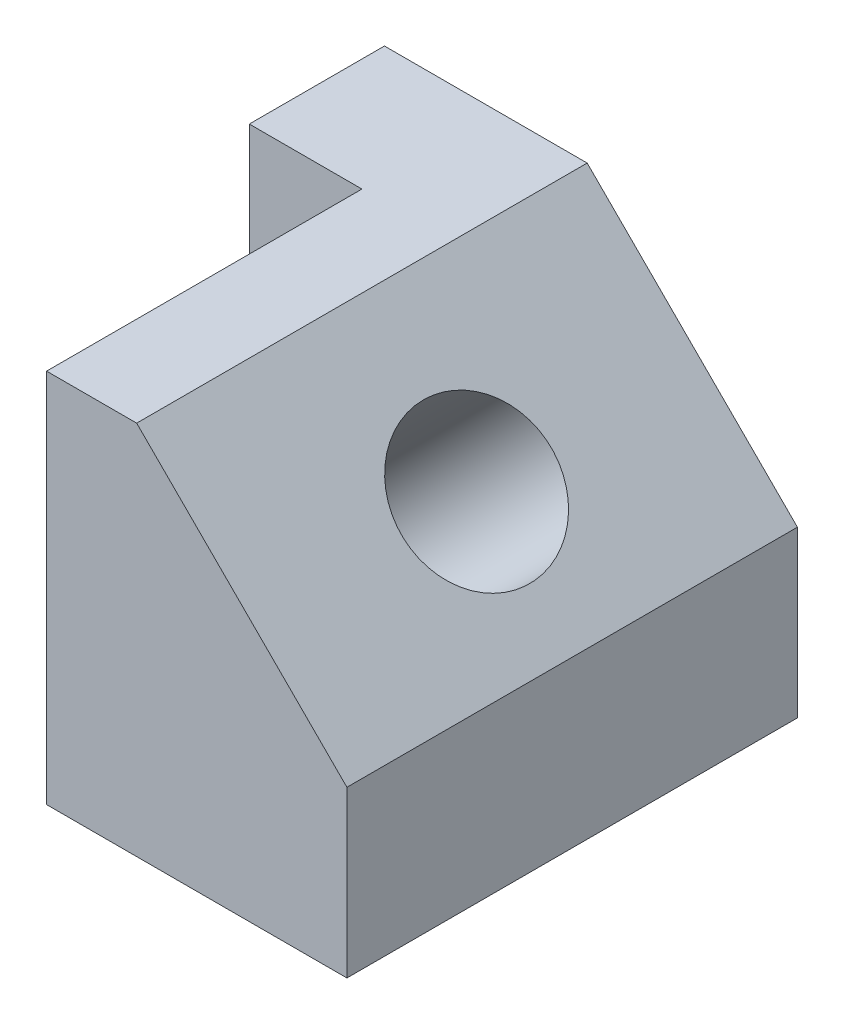
from build123d import *

# Parameters (mm, degrees)
SKETCH1_W           = 15
SKETCH1_H           = 50
BOSS_EXTRUDE1_DEPTH = 18
BOSS_EXTRUDE2_DEPTH = 60
SKETCH2_R           = 10
CUT_EXTRUDE2_DEPTH  = 60


with BuildPart() as part:
    # Sketch1 → Boss-Extrude1 (new body)
    with BuildSketch(Plane.XY):
        with Locations((-47.5, 25)):
            Rectangle(SKETCH1_W, SKETCH1_H)
    extrude(amount=BOSS_EXTRUDE1_DEPTH)

    # Sketch1<3> → Boss-Extrude2 (add)
    with BuildSketch(Plane.XY):
        Polygon((-28, 50), (-40, 50), (-40, 0), (0, 0), (0, 22), align=None)
    extrude(amount=BOSS_EXTRUDE2_DEPTH)

    # Sketch2 → Cut-Extrude2 (cut)
    with BuildSketch(Plane(origin=(11, 11, 0), x_dir=(0, 0, -1), z_dir=(0.7071067811865464, 0.7071067811865488, 0))):
        with Locations((-30, 33.556349186)):
            Circle(SKETCH2_R)
    extrude(amount=-CUT_EXTRUDE2_DEPTH, mode=Mode.SUBTRACT)


solid = part.part
